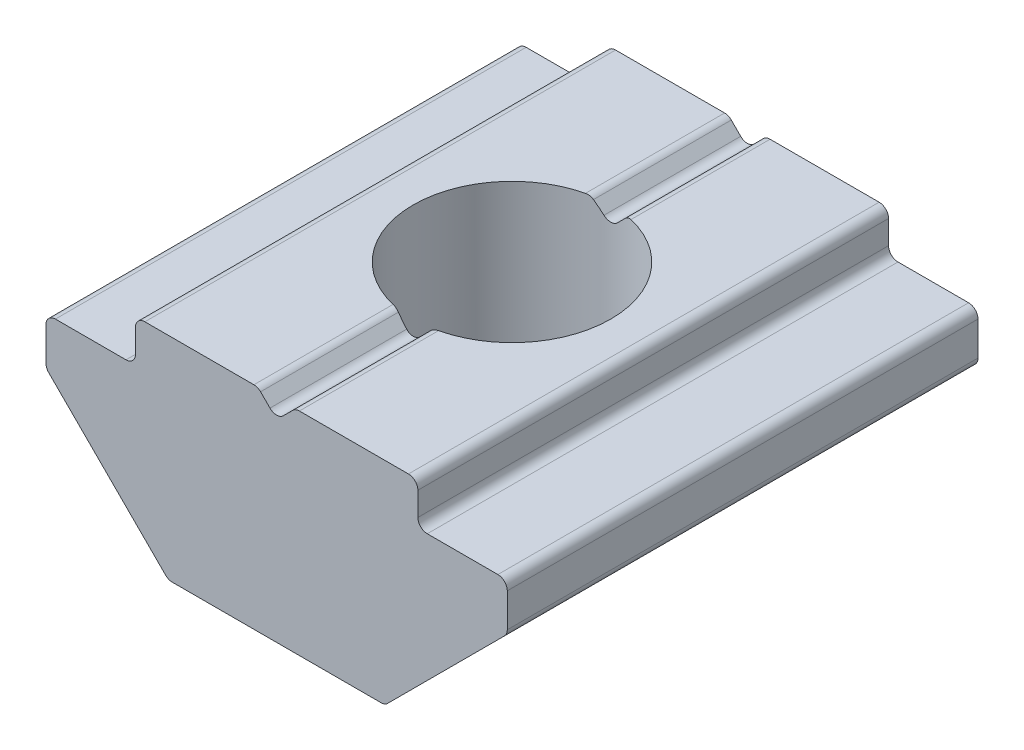
from build123d import *

# Parameters (mm, degrees)
BOSS_EXTRUDE1_DEPTH            = 10
SKETCH2_W                      = 1.9
SKETCH2_H                      = 0.9
CUT_EXTRUDE1_DEPTH             = 12.703418304
SKETCH3_W                      = 1.9
SKETCH3_H                      = 0.9
CUT_EXTRUDE2_DEPTH             = 12.703418304
CUT_EXTRUDE3_DEPTH             = 12.703418304
F_4_2_4_2_DIAMETER_HOLE1_D     = 4.2
F_4_2_4_2_DIAMETER_HOLE1_DEPTH = 4.5
FILLET1_R                      = 0.2


with BuildPart() as part:
    # Sketch1 → Boss-Extrude1 (new body)
    with BuildSketch(Plane.XY.offset(5)):
        Polygon((4.9, -1), (4.9, 0.9), (-4.9, 0.9), (-4.9, -1), (-2.3, -3.6), (2.3, -3.6), align=None)
    extrude(amount=-BOSS_EXTRUDE1_DEPTH)

    # Sketch2 → Cut-Extrude1 (cut, through all)
    with BuildSketch(Plane(origin=(0, 0, -5), x_dir=(-1, 0, 0), z_dir=(0, 0, -1))):
        with Locations((3.95, 0.45)):
            Rectangle(SKETCH2_W, SKETCH2_H)
    extrude(amount=-CUT_EXTRUDE1_DEPTH, mode=Mode.SUBTRACT)

    # Sketch3 → Cut-Extrude2 (cut, through all)
    with BuildSketch(Plane(origin=(0, 0, -5), x_dir=(-1, 0, 0), z_dir=(0, 0, -1))):
        with Locations((-3.95, 0.45)):
            Rectangle(SKETCH3_W, SKETCH3_H)
    extrude(amount=-CUT_EXTRUDE2_DEPTH, mode=Mode.SUBTRACT)

    # Sketch4 → Cut-Extrude3 (cut, through all)
    with BuildSketch(Plane(origin=(0, 0, -5), x_dir=(-1, 0, 0), z_dir=(0, 0, -1))):
        Polygon((0.4, 0.9), (-0.4, 0.9), (0, 0.5), align=None)
    extrude(amount=-CUT_EXTRUDE3_DEPTH, mode=Mode.SUBTRACT)

    # Ø4.2 (4.2) Diameter Hole1
    with Locations(Plane(origin=(0, -3.6, 0), x_dir=(-1, 0, 0), z_dir=(0, -1, 0))):
        with Locations((0, 0)):
            Hole(F_4_2_4_2_DIAMETER_HOLE1_D / 2, depth=F_4_2_4_2_DIAMETER_HOLE1_DEPTH)

    # Fillet1
    fillet1_edges = [part.edges().sort_by_distance(p)[0] for p in [
        (4.9, 0, 0),
        (3, 0, 0),
        (-4.9, -1, 0),
        (3, 0.9, 0),
        (-3, 0, 0),
        (0.4, 0.9, -3.530776406),
        (0, 0.5, 3.55),
        (-0.4, 0.9, -3.530776406),
        (4.9, -1, 0),
        (-3, 0.9, 0),
        (0, 0.5, -3.55),
        (-0.4, 0.9, 3.530776406),
        (-4.9, 0, 0),
        (-2.3, -3.6, 0),
        (0.4, 0.9, 3.530776406),
        (2.3, -3.6, 0),
    ]]
    fillet(fillet1_edges, radius=FILLET1_R)


solid = part.part
